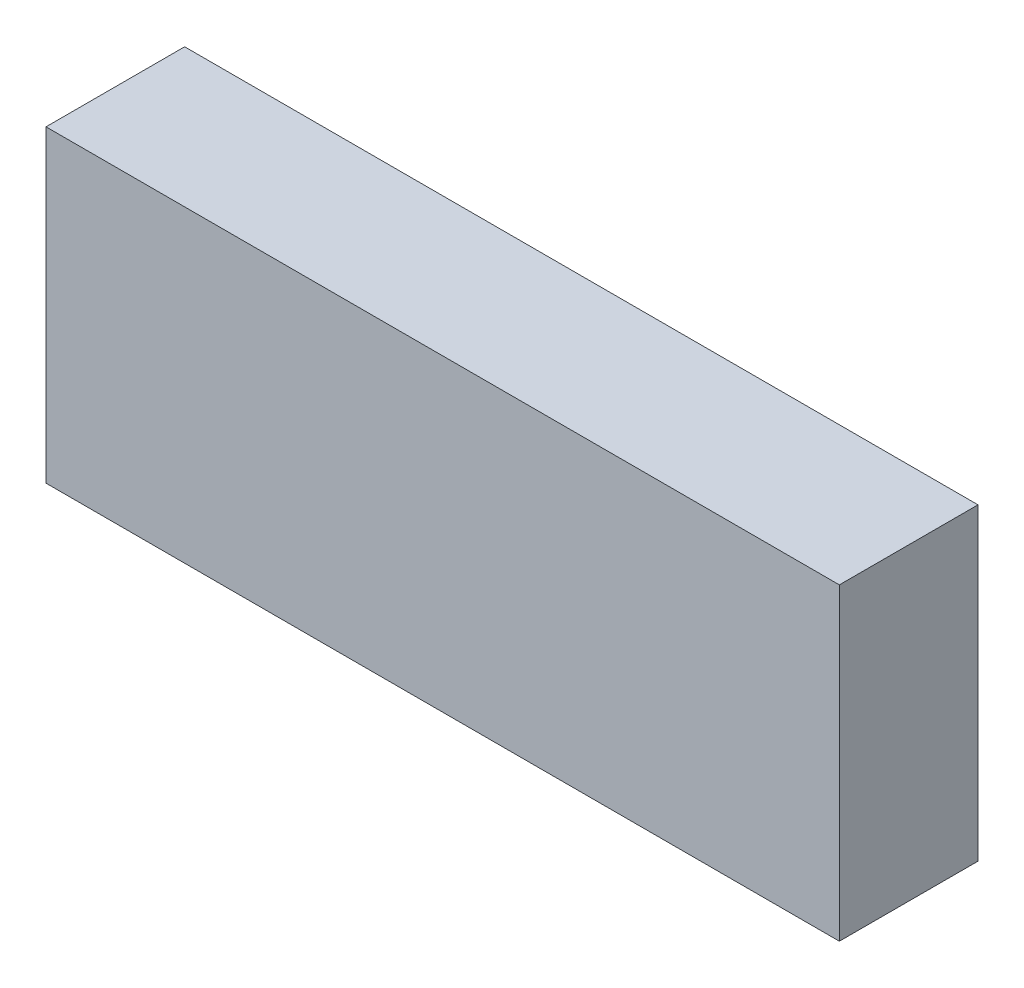
from build123d import *

# Parameters (mm, degrees)
SKETCH1_W           = 72.674083076
SKETCH1_H           = 28.271195995
BOSS_EXTRUDE1_DEPTH = 12.7


with BuildPart() as part:
    # Sketch1 → Boss-Extrude1 (new body)
    with BuildSketch(Plane.XY):
        with Locations((36.337041538, 14.135597998)):
            Rectangle(SKETCH1_W, SKETCH1_H)
    extrude(amount=BOSS_EXTRUDE1_DEPTH)


solid = part.part
